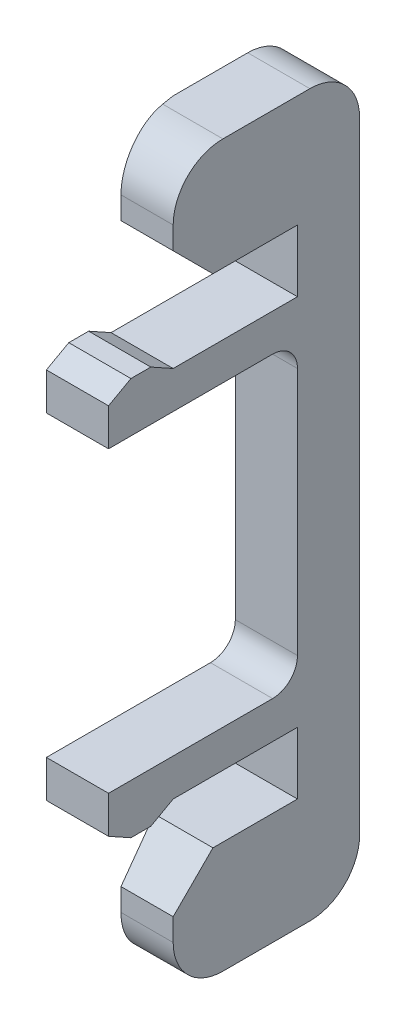
from build123d import *

# Parameters (mm, degrees)
SKETCH1_W          = 3.175
SKETCH1_H          = 36.83
BASE_DEPTH         = 3.175
SKETCH3_W          = 6.35
SKETCH3_H          = 5.715
RETAINER_DEPTH     = 3.175
TAB_DEPTH          = 3.175
FILLET1_R          = 1.27
FILLET2_R          = 2.54
CHAMFER1_SIZE      = 2.032
CUT_EXTRUDE1_REACH = 41.032


with BuildPart() as part:
    # Sketch1 → Base (new body)
    with BuildSketch(Plane.XY):
        Rectangle(SKETCH1_W, SKETCH1_H)
    extrude(amount=BASE_DEPTH)

    # Sketch3 → Retainer (add)
    with BuildSketch(Plane.ZY.offset(1.5875)):
        with Locations((6.35, 15.5575)):
            Rectangle(SKETCH3_W, SKETCH3_H)
        with Locations((6.35, -15.5575)):
            Rectangle(SKETCH3_W, SKETCH3_H)
    extrude(amount=-RETAINER_DEPTH)

    # Sketch5 → Tab (add)
    with BuildSketch(Plane.ZY.offset(1.5875)):
        Polygon((3.175, 9.525), (9.525, 9.525), (10.668, 10.16), (11.684, 10.16), (12.827, 9.525), (12.827, 7.62), (3.175, 7.62), align=None)
        Polygon((12.827, -7.62), (3.175, -7.62), (3.175, -9.525), (9.525, -9.525), (10.668, -10.16), (11.684, -10.16), (12.827, -9.525), align=None)
    extrude(amount=-TAB_DEPTH)

    # Fillet1
    fillet1_edges = [part.edges().sort_by_distance(p)[0] for p in [
        (0, 7.62, 3.175),
        (0, -7.62, 3.175),
    ]]
    fillet(fillet1_edges, radius=FILLET1_R)

    # Fillet2
    fillet2_edges = [part.edges().sort_by_distance(p)[0] for p in [
        (0, 18.415, 9.525),
        (0, -18.415, 9.525),
        (0, -18.415, 0),
        (0, 18.415, 0),
    ]]
    fillet(fillet2_edges, radius=FILLET2_R)

    # Chamfer1
    chamfer1_edges = [part.edges().sort_by_distance(p)[0] for p in [
        (0, 12.7, 9.525),
        (0, -12.7, 9.525),
    ]]
    chamfer(chamfer1_edges, length=CHAMFER1_SIZE)

    # Sketch6 → Cut-Extrude1 (cut, up to next)
    with BuildSketch(Plane(origin=(0, 18.415, 0), x_dir=(1, 0, 0), z_dir=(0, 1, 0)), mode=Mode.PRIVATE) as cut_extrude1_sk1:
        Polygon((-1.5875, -6.35), (-1.0795, -9.525), (-1.5875, -9.525), align=None)
    cut_extrude1_tool1 = extrude(cut_extrude1_sk1.sketch, amount=-CUT_EXTRUDE1_REACH, mode=Mode.PRIVATE) & part.part
    cut_extrude1 = cut_extrude1_tool1.solids().sort_by_distance((-1.418167, 18.415, 8.466667))[0]
    add(cut_extrude1, mode=Mode.SUBTRACT)

    # Mirror1: Cut-Extrude1 across plane
    add(cut_extrude1.mirror(Plane.ZX), mode=Mode.SUBTRACT)


solid = part.part
